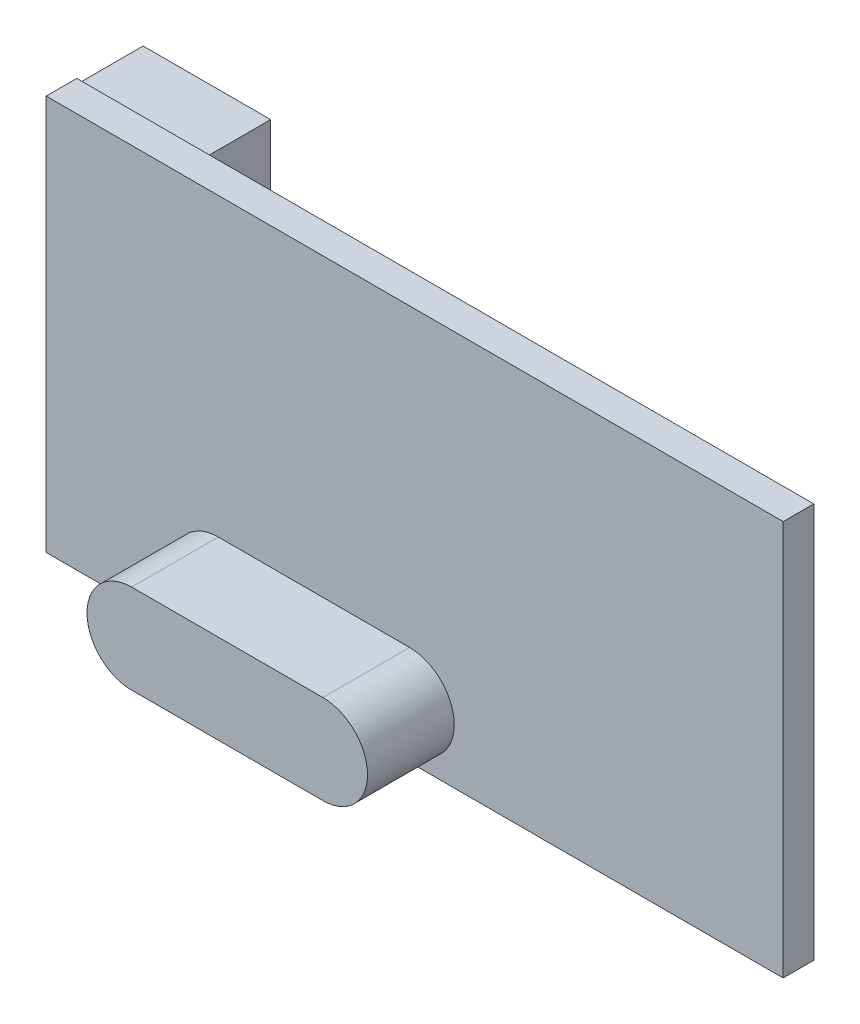
from build123d import *

# Parameters (mm, degrees)
BOSS_EXTRUDE1_DEPTH = 1.2
BOSS_EXTRUDE2_DEPTH = 3.4
SKETCH3_W           = 5
SKETCH3_H           = 10
BOSS_EXTRUDE3_DEPTH = 2.5


with BuildPart() as part:
    # Sketch1 → Boss-Extrude1 (new body)
    with BuildSketch(Plane.XY):
        Polygon((-14.45, 7.75), (14.45, 7.75), (-14.45, -7.75), align=None)
        Polygon((14.45, 7.75), (14.45, -7.75), (-14.45, -7.75), align=None)
    extrude(amount=BOSS_EXTRUDE1_DEPTH)

    # Sketch2 → Boss-Extrude2 (add)
    with BuildSketch(Plane.XY.offset(1.2)):
        with BuildLine():
            Line((-7.7, -3.85), (-0.2, -3.85))
            ThreePointArc((-0.2, -3.85), (1.55, -5.6), (-0.2, -7.35))
            Line((-0.2, -7.35), (-7.7, -7.35))
            ThreePointArc((-7.7, -7.35), (-9.45, -5.6), (-7.7, -3.85))
        make_face()
    extrude(amount=BOSS_EXTRUDE2_DEPTH)

    # Sketch3 → Boss-Extrude3 (add)
    with BuildSketch(Plane(origin=(0, 0, 0), x_dir=(-1, 0, 0), z_dir=(0, 0, -1))):
        with Locations((11.85, 2.65)):
            Rectangle(SKETCH3_W, SKETCH3_H)
    extrude(amount=BOSS_EXTRUDE3_DEPTH)


solid = part.part
